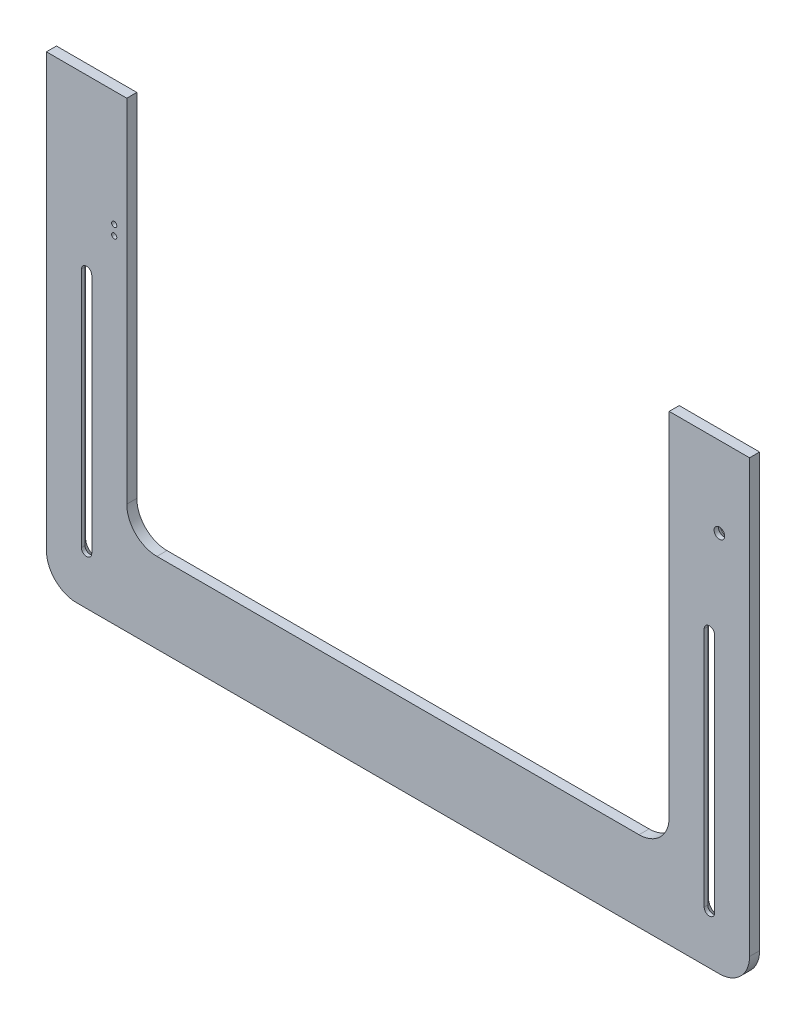
from build123d import *
from OCP.BRepFilletAPI import BRepFilletAPI_MakeChamfer

# Parameters (mm, degrees)
BOSS_EXTRUDE1_DEPTH                            = 6.35
FILLET5_R                                      = 19.05
FILLET6_R                                      = 19.05
FILLET7_R                                      = 19.05
FILLET8_R                                      = 19.05
CUT_EXTRUDE1_DEPTH                             = 532.923850283
CUT_EXTRUDE2_DEPTH                             = 532.923850283
CHAMFER1_SIZE                                  = 4.0894
CHAMFER1_SIZE2                                 = 3.682112299
CHAMFER2_SIZE                                  = 4.0894
CHAMFER2_SIZE2                                 = 3.682112299
F_62_0_038_DIAMETER_HOLE1_D                    = 0.9652
F_62_0_038_DIAMETER_HOLE1_DEPTH                = 25.4
F_62_0_038_DIAMETER_HOLE1_TIP                  = 0.289975335
CSK_FOR_4_FLAT_HEAD_MACHINE_SCREW3_D           = 3.2639
CSK_FOR_4_FLAT_HEAD_MACHINE_SCREW3_CSINK_D     = 5.715
CSK_FOR_4_FLAT_HEAD_MACHINE_SCREW3_CSINK_ANGLE = 82


with BuildPart() as part:
    # Sketch1 → Boss-Extrude1 (new body)
    with BuildSketch(Plane.XY):
        Polygon((0, 0), (0, -292.1), (444.5, -292.1), (444.5, 0), (393.7, 0), (393.7, -241.3), (50.8, -241.3), (50.8, 0), align=None)
    extrude(amount=BOSS_EXTRUDE1_DEPTH)

    # Fillet5
    fillet5_edges = [part.edges().sort_by_distance(p)[0] for p in [
        (0, -292.1, 3.175),
    ]]
    fillet(fillet5_edges, radius=FILLET5_R)

    # Fillet6
    fillet6_edges = [part.edges().sort_by_distance(p)[0] for p in [
        (444.5, -292.1, 3.175),
    ]]
    fillet(fillet6_edges, radius=FILLET6_R)

    # Fillet7
    fillet7_edges = [part.edges().sort_by_distance(p)[0] for p in [
        (50.8, -241.3, 3.175),
    ]]
    fillet(fillet7_edges, radius=FILLET7_R)

    # Fillet8
    fillet8_edges = [part.edges().sort_by_distance(p)[0] for p in [
        (393.7, -241.3, 3.175),
    ]]
    fillet(fillet8_edges, radius=FILLET8_R)

    # Sketch2 → Cut-Extrude1 (cut, through all)
    with BuildSketch(Plane.XY.offset(6.35)):
        with BuildLine():
            Line((422.3639, -107.95), (422.3639, -260.35))
            ThreePointArc((422.3639, -260.35), (419.1, -263.6139), (415.8361, -260.35))
            Line((415.8361, -260.35), (415.8361, -107.95))
            ThreePointArc((415.8361, -107.95), (419.1, -104.6861), (422.3639, -107.95))
        make_face()
    extrude(amount=-CUT_EXTRUDE1_DEPTH, mode=Mode.SUBTRACT)

    # Sketch3 → Cut-Extrude2 (cut, through all)
    with BuildSketch(Plane.XY.offset(6.35)):
        with BuildLine():
            Line((28.6639, -107.95), (28.6639, -260.35))
            ThreePointArc((28.6639, -260.35), (25.4, -263.6139), (22.1361, -260.35))
            Line((22.1361, -260.35), (22.1361, -107.95))
            ThreePointArc((22.1361, -107.95), (25.4, -104.6861), (28.6639, -107.95))
        make_face()
    extrude(amount=-CUT_EXTRUDE2_DEPTH, mode=Mode.SUBTRACT)

    # Sketch4 → CSK for 1/4 Flat Head Machine Screw1 (revolve, cut)
    with BuildSketch(Plane(origin=(425.45, -50.8, 0), x_dir=(0, 1, 0), z_dir=(1, 0, 0))):
        Polygon((0, 0), (0, 6.35), (3.3782, 6.35), (3.3782, 3.520932584), (6.4389, 0), align=None)
    revolve(axis=Axis((425.45, -50.8, -6.35), (0, 0, 1)), mode=Mode.SUBTRACT)

    # Chamfer1: one chamfer whose edges measure the first distance from different faces: ONE call of the kernel's chamfer builder (chamfer() names one face for all edges)
    chamfer1_edges_1 = [part.edges().sort_by_distance(p)[0] for p in [
        (25.4, -104.6861, 0),
    ]]
    chamfer1_side_1 = [part.faces().sort_by_distance(p)[0] for p in [
        (25.4, -104.6861, 3.175),
    ]]
    chamfer1_edges_2 = [part.edges().sort_by_distance(p)[0] for p in [
        (28.6639, -184.15, 0),
    ]]
    chamfer1_side_2 = [part.faces().sort_by_distance(p)[0] for p in [
        (28.6639, -184.15, 3.175),
    ]]
    chamfer1_edges_3 = [part.edges().sort_by_distance(p)[0] for p in [
        (25.4, -263.6139, 0),
    ]]
    chamfer1_side_3 = [part.faces().sort_by_distance(p)[0] for p in [
        (25.4, -263.6139, 3.175),
    ]]
    chamfer1_edges_4 = [part.edges().sort_by_distance(p)[0] for p in [
        (22.1361, -184.15, 0),
    ]]
    chamfer1_side_4 = [part.faces().sort_by_distance(p)[0] for p in [
        (22.1361, -184.15, 3.175),
    ]]
    chamfer1 = BRepFilletAPI_MakeChamfer(part.part.solid().wrapped)
    for e in chamfer1_edges_1:
        chamfer1.Add(CHAMFER1_SIZE, CHAMFER1_SIZE2, e.wrapped, chamfer1_side_1[0].wrapped)  # the first distance lies on this face
    for e in chamfer1_edges_2:
        chamfer1.Add(CHAMFER1_SIZE, CHAMFER1_SIZE2, e.wrapped, chamfer1_side_2[0].wrapped)  # the first distance lies on this face
    for e in chamfer1_edges_3:
        chamfer1.Add(CHAMFER1_SIZE, CHAMFER1_SIZE2, e.wrapped, chamfer1_side_3[0].wrapped)  # the first distance lies on this face
    for e in chamfer1_edges_4:
        chamfer1.Add(CHAMFER1_SIZE, CHAMFER1_SIZE2, e.wrapped, chamfer1_side_4[0].wrapped)  # the first distance lies on this face
    add(Compound.cast(chamfer1.Shape()), mode=Mode.REPLACE)

    # Chamfer2: one chamfer whose edges measure the first distance from different faces: ONE call of the kernel's chamfer builder (chamfer() names one face for all edges)
    chamfer2_edges_1 = [part.edges().sort_by_distance(p)[0] for p in [
        (419.1, -104.6861, 0),
    ]]
    chamfer2_side_1 = [part.faces().sort_by_distance(p)[0] for p in [
        (419.1, -104.6861, 3.175),
    ]]
    chamfer2_edges_2 = [part.edges().sort_by_distance(p)[0] for p in [
        (422.3639, -184.15, 0),
    ]]
    chamfer2_side_2 = [part.faces().sort_by_distance(p)[0] for p in [
        (422.3639, -184.15, 3.175),
    ]]
    chamfer2_edges_3 = [part.edges().sort_by_distance(p)[0] for p in [
        (419.1, -263.6139, 0),
    ]]
    chamfer2_side_3 = [part.faces().sort_by_distance(p)[0] for p in [
        (419.1, -263.6139, 3.175),
    ]]
    chamfer2_edges_4 = [part.edges().sort_by_distance(p)[0] for p in [
        (415.8361, -184.15, 0),
    ]]
    chamfer2_side_4 = [part.faces().sort_by_distance(p)[0] for p in [
        (415.8361, -184.15, 3.175),
    ]]
    chamfer2 = BRepFilletAPI_MakeChamfer(part.part.solid().wrapped)
    for e in chamfer2_edges_1:
        chamfer2.Add(CHAMFER2_SIZE, CHAMFER2_SIZE2, e.wrapped, chamfer2_side_1[0].wrapped)  # the first distance lies on this face
    for e in chamfer2_edges_2:
        chamfer2.Add(CHAMFER2_SIZE, CHAMFER2_SIZE2, e.wrapped, chamfer2_side_2[0].wrapped)  # the first distance lies on this face
    for e in chamfer2_edges_3:
        chamfer2.Add(CHAMFER2_SIZE, CHAMFER2_SIZE2, e.wrapped, chamfer2_side_3[0].wrapped)  # the first distance lies on this face
    for e in chamfer2_edges_4:
        chamfer2.Add(CHAMFER2_SIZE, CHAMFER2_SIZE2, e.wrapped, chamfer2_side_4[0].wrapped)  # the first distance lies on this face
    add(Compound.cast(chamfer2.Shape()), mode=Mode.REPLACE)

    # #62 (0.038) Diameter Hole1
    with Locations(Plane.XY.offset(6.35)):
        with Locations((42.8625, -73.025), (42.8625, -79.375)):
            Hole(F_62_0_038_DIAMETER_HOLE1_D / 2, depth=F_62_0_038_DIAMETER_HOLE1_DEPTH)
            with Locations((0, 0, -(F_62_0_038_DIAMETER_HOLE1_DEPTH + F_62_0_038_DIAMETER_HOLE1_TIP / 2))):  # 118° drill point
                Cone(0, F_62_0_038_DIAMETER_HOLE1_D / 2, F_62_0_038_DIAMETER_HOLE1_TIP, mode=Mode.SUBTRACT)

    # CSK for #4 Flat Head Machine Screw3 (through all)
    with Locations(Plane(origin=(0, 0, 0), x_dir=(-1, 0, 0), z_dir=(0, 0, -1))):
        with Locations((-42.8625, -79.375), (-42.8625, -73.025)):
            CounterSinkHole(CSK_FOR_4_FLAT_HEAD_MACHINE_SCREW3_D / 2, CSK_FOR_4_FLAT_HEAD_MACHINE_SCREW3_CSINK_D / 2, counter_sink_angle=CSK_FOR_4_FLAT_HEAD_MACHINE_SCREW3_CSINK_ANGLE)


solid = part.part
